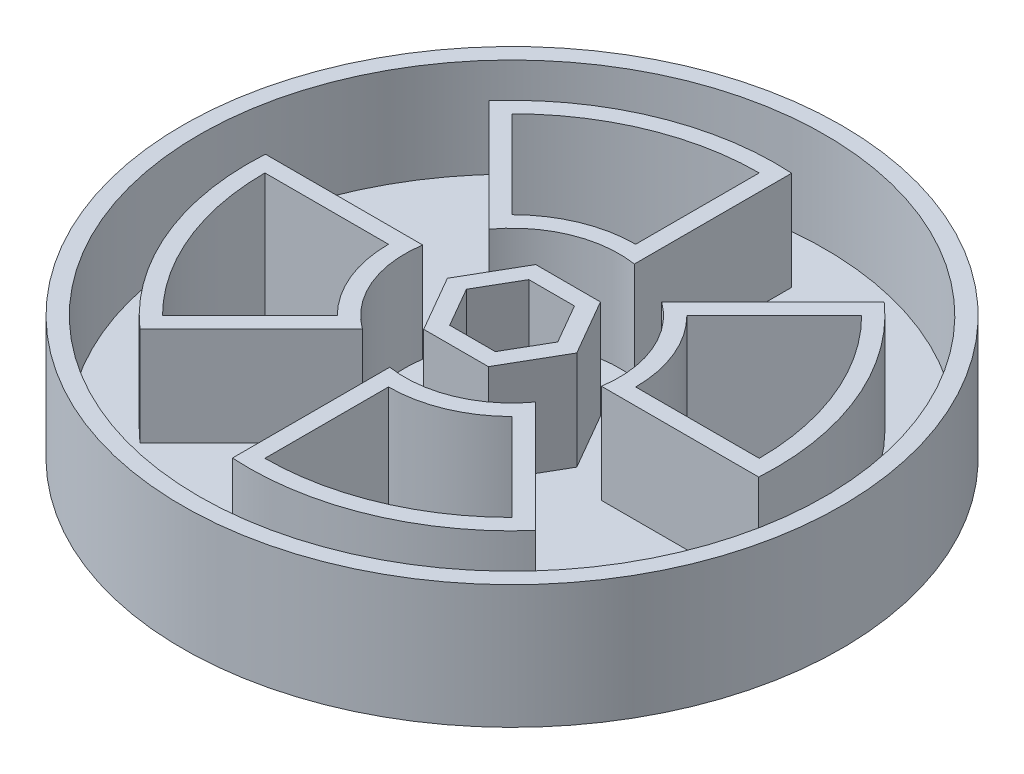
from build123d import *

# Parameters (mm, degrees)
SKETCH1_R           = 50.8
BOSS_EXTRUDE1_DEPTH = 19.05
CUT_EXTRUDE2_DEPTH  = 15.24
SKETCH5_R           = 4.064
CUT_EXTRUDE3_DEPTH  = 74.440708058
CUT_EXTRUDE4_DEPTH  = 75.324844433
SKETCH7_R           = 48.26
GUTTED_DEPTH        = 15.24


with BuildPart() as part:
    # Sketch1 → Boss-Extrude1 (new body)
    with BuildSketch(Plane(origin=(0, 0, 0), x_dir=(1, 0, 0), z_dir=(0, 1, 0))):
        with Locations(Location((0, 0, 0), (0, 0, 90))):
            Circle(SKETCH1_R)
    extrude(amount=BOSS_EXTRUDE1_DEPTH)

    # Sketch4 → Cut-Extrude2 (cut)
    with BuildSketch(Plane(origin=(0, 19.05, 0), x_dir=(1, 0, 0), z_dir=(0, 1, 0))):
        Polygon((-3.519527241, 6.096), (3.519527241, 6.096), (7.039054482, 0), (3.519527241, -6.096), (-3.519527241, -6.096), (-7.039054482, 0), align=None)
    extrude(amount=-CUT_EXTRUDE2_DEPTH, mode=Mode.SUBTRACT)

    # Sketch5 → Cut-Extrude3 (cut, through all)
    with BuildSketch(Plane(origin=(0, 3.81, 0), x_dir=(1, 0, 0), z_dir=(0, 1, 0))):
        with Locations(Location((0, 0, 0), (0, 0, 270))):
            Circle(SKETCH5_R)
    extrude(amount=-CUT_EXTRUDE3_DEPTH, mode=Mode.SUBTRACT)

    # Sketch6 → Cut-Extrude4 (cut, through all)
    with BuildSketch(Plane(origin=(0, 19.05, 0), x_dir=(1, 0, 0), z_dir=(0, 1, 0))):
        with BuildLine():
            ThreePointArc((-13.470384182, 13.470384182), (-7.290119387, 17.599905094), (0, 19.05))
            Line((0, 19.05), (0, 38.1))
            ThreePointArc((0, 38.1), (-14.580238773, 35.199810189), (-26.940768363, 26.940768363))
            Line((-26.940768363, 26.940768363), (-13.470384182, 13.470384182))
        make_face()
        with BuildLine():
            Line((26.940768363, 26.940768363), (13.470384182, 13.470384182))
            ThreePointArc((13.470384182, 13.470384182), (17.599905094, 7.290119387), (19.05, 0))
            Line((19.05, 0), (38.1, 0))
            ThreePointArc((38.1, 0), (35.199810189, 14.580238773), (26.940768363, 26.940768363))
        make_face()
        with BuildLine():
            Line((26.940768363, -26.940768363), (13.470384182, -13.470384182))
            ThreePointArc((13.470384182, -13.470384182), (7.290119387, -17.599905094), (0, -19.05))
            Line((0, -19.05), (0, -38.1))
            ThreePointArc((0, -38.1), (14.580238773, -35.199810189), (26.940768363, -26.940768363))
        make_face()
        with BuildLine():
            Line((-26.940768363, -26.940768363), (-13.470384182, -13.470384182))
            ThreePointArc((-13.470384182, -13.470384182), (-17.599905094, -7.290119387), (-19.05, 0))
            Line((-19.05, 0), (-38.1, 0))
            ThreePointArc((-38.1, 0), (-35.199810189, -14.580238773), (-26.940768363, -26.940768363))
        make_face()
    extrude(amount=-CUT_EXTRUDE4_DEPTH, mode=Mode.SUBTRACT)

    # Sketch7 → gutted (cut)
    with BuildSketch(Plane(origin=(0, 19.05, 0), x_dir=(1, 0, 0), z_dir=(0, 1, 0))):
        with Locations(Location((0, 0, 0), (0, 0, 270))):
            Circle(SKETCH7_R)
        with BuildLine():
            Line((-16.313445375, 2.54), (-40.560547334, 2.54))
            ThreePointArc((-40.560547334, 2.54), (-37.546464201, -15.552254691), (-26.884586844, -30.476689292))
            Line((-26.884586844, -30.476689292), (-9.739296625, -13.331399073))
            ThreePointArc((-9.739296625, -13.331399073), (-15.253251082, -6.318103468), (-16.313445375, 2.54))
        make_face(mode=Mode.SUBTRACT)
        with BuildLine():
            Line((16.313445375, -2.54), (40.560547334, -2.54))
            ThreePointArc((40.560547334, -2.54), (37.546464201, 15.552254691), (26.884586844, 30.476689292))
            Line((26.884586844, 30.476689292), (9.739296625, 13.331399073))
            ThreePointArc((9.739296625, 13.331399073), (15.253251082, 6.318103468), (16.313445375, -2.54))
        make_face(mode=Mode.SUBTRACT)
        Polygon((4.985996925, 8.636), (-4.985996925, 8.636), (-9.971993849, 0), (-4.985996925, -8.636), (4.985996925, -8.636), (9.971993849, 0), align=None, mode=Mode.SUBTRACT)
        with BuildLine():
            ThreePointArc((2.54, 40.560547334), (-15.552254691, 37.546464201), (-30.476689292, 26.884586844))
            Line((-30.476689292, 26.884586844), (-13.331399073, 9.739296625))
            ThreePointArc((-13.331399073, 9.739296625), (-6.318103468, 15.253251082), (2.54, 16.313445375))
            Line((2.54, 16.313445375), (2.54, 40.560547334))
        make_face(mode=Mode.SUBTRACT)
        with BuildLine():
            Line((-2.54, -16.313445375), (-2.54, -40.560547334))
            ThreePointArc((-2.54, -40.560547334), (15.552254691, -37.546464201), (30.476689292, -26.884586844))
            Line((30.476689292, -26.884586844), (13.331399073, -9.739296625))
            ThreePointArc((13.331399073, -9.739296625), (6.318103468, -15.253251082), (-2.54, -16.313445375))
        make_face(mode=Mode.SUBTRACT)
    extrude(amount=-GUTTED_DEPTH, mode=Mode.SUBTRACT)


solid = part.part
